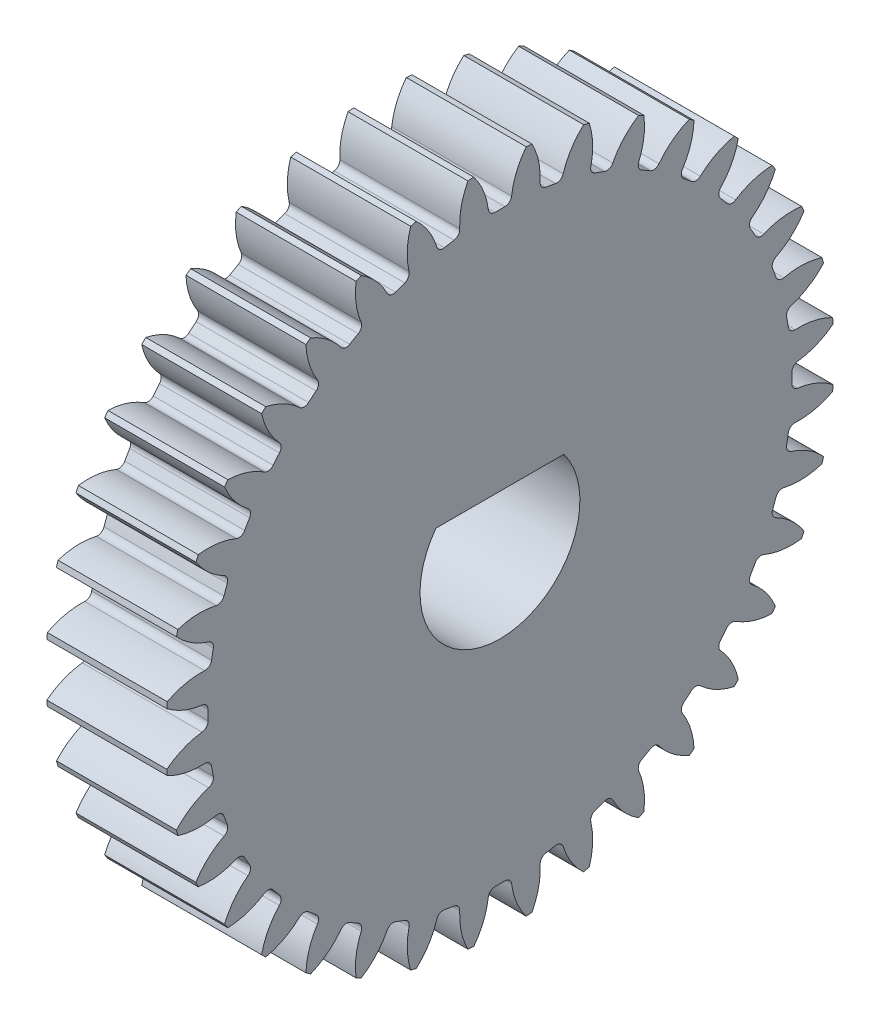
from build123d import *

# Parameters (mm, degrees)
SKETCH1_R                = 20.9
SKETCH1_R_2              = 5
BOSS_EXTRUDE2_DEPTH      = 7.5
CUT_EXTRUDE1_DEPTH       = 31.493769855
FILLET1_R                = 0.418
CIRPATTERN2_COUNT        = 36
FILLET1_OF_CIRPATTERN2_R = 0.418
BOSS_EXTRUDE3_START      = -7.5
BOSS_EXTRUDE3_DEPTH      = 7.5


with BuildPart() as part:
    # Sketch1 → Boss-Extrude2 (new body)
    with BuildSketch(Plane(origin=(0, 0, 0), x_dir=(0, 0, -1), z_dir=(1, 0, 0))):
        Circle(SKETCH1_R)
        Circle(SKETCH1_R_2, mode=Mode.SUBTRACT)
    extrude(amount=BOSS_EXTRUDE2_DEPTH)

    # Sketch3 → Cut-Extrude1 (cut, through all)
    with BuildSketch(Plane(origin=(7.5, 0, 0), x_dir=(0, 0, -1), z_dir=(1, 0, 0))):
        with BuildLine():
            ThreePointArc((0.699489703, 18.246597331), (0, 18.26), (-0.699489703, 18.246597331))
            ThreePointArc((-0.699489703, 18.246597331), (-0.967863891, 19.614804062), (-1.64174367, 20.835418828))
            ThreePointArc((-1.64174367, 20.835418828), (0, 20.9), (1.64174367, 20.835418828))
            ThreePointArc((1.64174367, 20.835418828), (0.967863891, 19.614804062), (0.699489703, 18.246597331))
        make_face()
    cut_extrude1 = extrude(amount=-CUT_EXTRUDE1_DEPTH, mode=Mode.SUBTRACT)

    # Fillet1
    fillet1_edges = [part.edges().sort_by_distance(p)[0] for p in [
        (3.75, 18.246597331, 0.699489703),
        (3.75, 18.246597331, -0.699489703),
    ]]
    fillet(fillet1_edges, radius=FILLET1_R)

    # CirPattern2: Cut-Extrude1 ×36 about axis
    cirpattern2_axis = Axis((0, 0, 0), (1, 0, 0))
    for i in range(1, CIRPATTERN2_COUNT):
        add(cut_extrude1.rotate(cirpattern2_axis, i * 360 / CIRPATTERN2_COUNT), mode=Mode.SUBTRACT)

    # Fillet1 of CirPattern2
    fillet1_of_cirpattern2_edges = [part.edges().sort_by_distance(p)[0] for p in [
        (3.75, 17.847925405, 3.857351258),
        (3.75, 18.09085563, 2.479625493),
        (3.75, 16.906953298, 6.898009146),
        (3.75, 17.385432435, 5.583398522),
        (3.75, 15.45227197, 9.729074518),
        (3.75, 16.151761673, 8.517522813),
        (3.75, 13.528081177, 12.264526883),
        (3.75, 14.427327805, 11.192846483),
        (3.75, 11.192846483, 14.427327805),
        (3.75, 12.264526883, 13.528081177),
        (3.75, 8.517522813, 16.151761673),
        (3.75, 9.729074518, 15.45227197),
        (3.75, 5.583398522, 17.385432435),
        (3.75, 6.898009146, 16.906953298),
        (3.75, 2.479625493, 18.09085563),
        (3.75, 3.857351258, 17.847925405),
        (3.75, -0.699489703, 18.246597331),
        (3.75, 0.699489703, 18.246597331),
        (3.75, -3.857351258, 17.847925405),
        (3.75, -2.479625493, 18.09085563),
        (3.75, -6.898009146, 16.906953298),
        (3.75, -5.583398522, 17.385432435),
        (3.75, -9.729074518, 15.45227197),
        (3.75, -8.517522813, 16.151761673),
        (3.75, -12.264526883, 13.528081177),
        (3.75, -11.192846483, 14.427327805),
        (3.75, -14.427327805, 11.192846483),
        (3.75, -13.528081177, 12.264526883),
        (3.75, -16.151761673, 8.517522813),
        (3.75, -15.45227197, 9.729074518),
        (3.75, -17.385432435, 5.583398522),
        (3.75, -16.906953298, 6.898009146),
        (3.75, -18.09085563, 2.479625493),
        (3.75, -17.847925405, 3.857351258),
        (3.75, -18.246597331, -0.699489703),
        (3.75, -18.246597331, 0.699489703),
        (3.75, -17.847925405, -3.857351258),
        (3.75, -18.09085563, -2.479625493),
        (3.75, -16.906953298, -6.898009146),
        (3.75, -17.385432435, -5.583398522),
        (3.75, -15.45227197, -9.729074518),
        (3.75, -16.151761673, -8.517522813),
        (3.75, -13.528081177, -12.264526883),
        (3.75, -14.427327805, -11.192846483),
        (3.75, -11.192846483, -14.427327805),
        (3.75, -12.264526883, -13.528081177),
        (3.75, -8.517522813, -16.151761673),
        (3.75, -9.729074518, -15.45227197),
        (3.75, -5.583398522, -17.385432435),
        (3.75, -6.898009146, -16.906953298),
        (3.75, -2.479625493, -18.09085563),
        (3.75, -3.857351258, -17.847925405),
        (3.75, 0.699489703, -18.246597331),
        (3.75, -0.699489703, -18.246597331),
        (3.75, 3.857351258, -17.847925405),
        (3.75, 2.479625493, -18.09085563),
        (3.75, 6.898009146, -16.906953298),
        (3.75, 5.583398522, -17.385432435),
        (3.75, 9.729074518, -15.45227197),
        (3.75, 8.517522813, -16.151761673),
        (3.75, 12.264526883, -13.528081177),
        (3.75, 11.192846483, -14.427327805),
        (3.75, 14.427327805, -11.192846483),
        (3.75, 13.528081177, -12.264526883),
        (3.75, 16.151761673, -8.517522813),
        (3.75, 15.45227197, -9.729074518),
        (3.75, 17.385432435, -5.583398522),
        (3.75, 16.906953298, -6.898009146),
        (3.75, 18.09085563, -2.479625493),
        (3.75, 17.847925405, -3.857351258),
    ]]
    fillet(fillet1_of_cirpattern2_edges, radius=FILLET1_OF_CIRPATTERN2_R)

    # Sketch4 → Boss-Extrude3 (add)
    with BuildSketch(Plane(origin=(7.5, 0, 0), x_dir=(0, 0, -1), z_dir=(1, 0, 0)).offset(BOSS_EXTRUDE3_START)):
        with BuildLine():
            Line((-4, 3), (4, 3))
            ThreePointArc((4, 3), (0, 5), (-4, 3))
        make_face()
    extrude(amount=BOSS_EXTRUDE3_DEPTH)


solid = part.part
